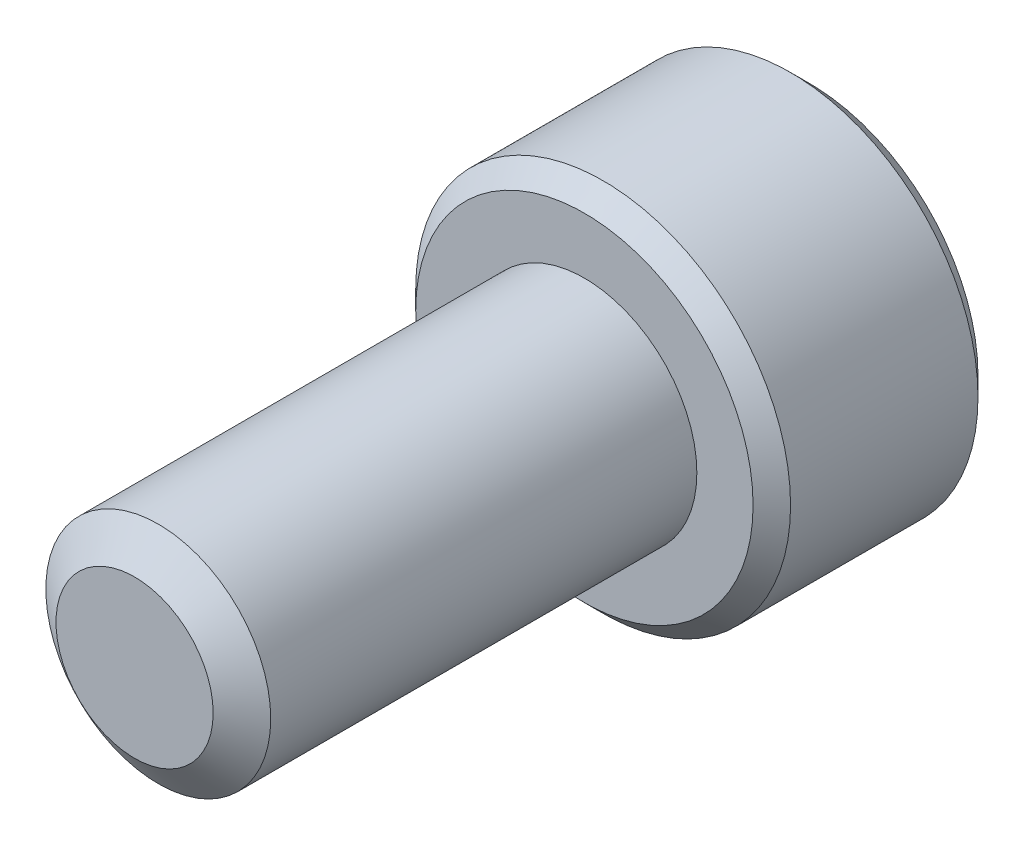
from build123d import *

# Parameters (mm, degrees)
SKETCH1_R          = 3
EXTRUDE1_DEPTH     = 12
SKETCH6_R          = 5
EXTRUDE2_DEPTH     = 6
CUT_EXTRUDE1_DEPTH = 3.75
CHAMFER1_SIZE      = 0.5


with BuildPart() as part:
    # Sketch1 → Extrude1 (new body)
    with BuildSketch(Plane.XY):
        Circle(SKETCH1_R)
    extrude(amount=-EXTRUDE1_DEPTH)

    # Sketch4 → Cut-Revolve1 (revolve, cut)
    with BuildSketch(Plane(origin=(0, 0, 0), x_dir=(0, 0, -1), z_dir=(1, 0, 0))):
        Polygon((0.632650852, 3), (0, 2.096480947), (0, 3), align=None)
    revolve(axis=Axis((0, 0, 0), (0, 0, -1)), mode=Mode.SUBTRACT)

    # Sketch6 → Extrude2 (add)
    with BuildSketch(Plane(origin=(0, 0, -12), x_dir=(-1, 0, 0), z_dir=(0, 0, -1))):
        Circle(SKETCH6_R)
    extrude(amount=EXTRUDE2_DEPTH)

    # Sketch7 → Cut-Extrude1 (cut)
    with BuildSketch(Plane(origin=(0, 0, -18), x_dir=(-1, 0, 0), z_dir=(0, 0, -1))):
        Polygon((0, 2.886751346), (-2.5, 1.443375673), (-2.5, -1.443375673), (0, -2.886751346), (2.5, -1.443375673), (2.5, 1.443375673), align=None)
    extrude(amount=-CUT_EXTRUDE1_DEPTH, mode=Mode.SUBTRACT)

    # Cut-Extrude2 cone 1 section (through the dimple's axis) → Cut-Extrude2 (revolve, cut)
    with BuildSketch(Plane(origin=(0, 0, -18), x_dir=(0, 1, 0), z_dir=(1, 0, 0))):
        Polygon((0, 0), (2.886751346, 0), (0, 2.886751346), align=None)
    revolve(axis=Axis((0, 0, -18), (0, 0, 1)), mode=Mode.SUBTRACT)

    # Chamfer1
    chamfer1_edges = [part.edges().sort_by_distance(p)[0] for p in [
        (5, 0, -18),
        (5, 0, -12),
    ]]
    chamfer(chamfer1_edges, length=CHAMFER1_SIZE)


solid = part.part
